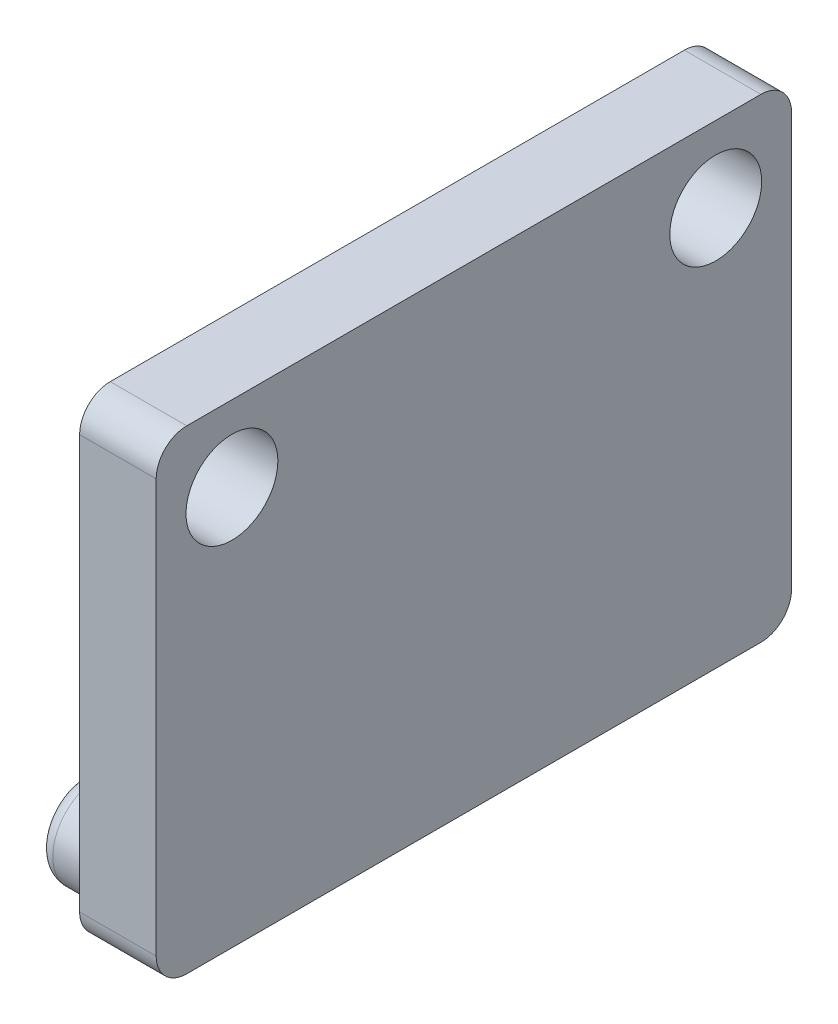
from build123d import *

# Parameters (mm, degrees)
SKETCH1_R                               = 2.25
SKETCH1_R_2                             = 17.5641
BOSS_EXTRUDE1_DEPTH                     = 4.365625
SKETCH2_W                               = 78.1
SKETCH2_H                               = 43.1
BOSS_EXTRUDE2_DEPTH                     = 8.73125
M4_CLEARANCE_HOLE2_AT_2_COUNT           = 2
M4_CLEARANCE_HOLE2_AT_2_PITCH           = 28.1
M4_CLEARANCE_HOLE2_AT_3_COUNT           = 2
M4_CLEARANCE_HOLE2_AT_3_PITCH           = 69.07401827
M4_CLEARANCE_HOLE2_AT_4_COUNT           = 2
M4_CLEARANCE_HOLE2_AT_4_PITCH           = 63.1
SKETCH24_W                              = 78.1
SKETCH24_H                              = 43.1
BOSS_EXTRUDE3_DEPTH                     = 8.73125
TAP_DRILL_FOR_M4X0_7_TAP1_AT_2_COUNT    = 2
TAP_DRILL_FOR_M4X0_7_TAP1_AT_2_PITCH    = 28.1
TAP_DRILL_FOR_M4X0_7_TAP1_AT_3_COUNT    = 2
TAP_DRILL_FOR_M4X0_7_TAP1_AT_3_PITCH    = 69.07401827
TAP_DRILL_FOR_M4X0_7_TAP1_AT_4_COUNT    = 2
TAP_DRILL_FOR_M4X0_7_TAP1_AT_4_PITCH    = 63.1
TAP_DRILL_FOR_M3X0_5_TAP1_AT_2_COUNT    = 2
TAP_DRILL_FOR_M3X0_5_TAP1_AT_2_PITCH    = 36
TAP_DRILL_FOR_M3X0_5_TAP1_AT_3_COUNT    = 2
TAP_DRILL_FOR_M3X0_5_TAP1_AT_3_PITCH    = 28
TAP_DRILL_FOR_M3X0_5_TAP1_AT_4_COUNT    = 2
TAP_DRILL_FOR_M3X0_5_TAP1_AT_4_PITCH    = 45.607017004
TAP_DRILL_FOR_M2_5X0_45_TAP2_AT_2_COUNT = 2
TAP_DRILL_FOR_M2_5X0_45_TAP2_AT_2_PITCH = 15.8
SKETCH3_R                               = 17.5641
CUT_EXTRUDE3_DEPTH                      = 181.027817403
M6_CLEARANCE_HOLE2_AT_2_COUNT           = 2
M6_CLEARANCE_HOLE2_AT_2_PITCH           = 80
SKETCH14_W                              = 86.5
SKETCH14_H                              = 58.5
CUT_EXTRUDE4_DEPTH                      = 2
FILLET4_R                               = 10
M4_CLEARANCE_HOLE1_AT_2_COUNT           = 2
M4_CLEARANCE_HOLE1_AT_2_PITCH           = 14.136551913
M4_CLEARANCE_HOLE1_AT_3_COUNT           = 2
M4_CLEARANCE_HOLE1_AT_3_PITCH           = 7.068275957
M6_CLEARANCE_HOLE1_AT_2_COUNT           = 2
M6_CLEARANCE_HOLE1_AT_2_PITCH           = 25.4
FILLET5_R                               = 5
FILLET6_R                               = 5
SKETCH28_W                              = 15.5
SKETCH28_H                              = 20.75
SKETCH28_R                              = 1.5
BOSS_EXTRUDE4_DEPTH                     = 2.5
FILLET7_R                               = 1
SKETCH29_R                              = 1.5
BOSS_EXTRUDE5_DEPTH                     = 1.5
FILLET8_R                               = 0.5


with BuildPart() as part:
    # Sketch1 → Boss-Extrude1 (new, symmetric)
    with BuildSketch(Plane.YZ):
        Polygon((0, 170.95), (-50, 110.95), (-50, -79.05), (50, -79.05), (50, 110.95), align=None)
        with Locations((-26.25, -56.8)):
            Circle(SKETCH1_R, mode=Mode.SUBTRACT)
        with Locations((-26.25, -32.3)):
            Circle(SKETCH1_R, mode=Mode.SUBTRACT)
        with Locations((26.25, -56.8)):
            Circle(SKETCH1_R, mode=Mode.SUBTRACT)
        with Locations((26.25, -32.3)):
            Circle(SKETCH1_R, mode=Mode.SUBTRACT)
        Circle(SKETCH1_R_2, mode=Mode.SUBTRACT)
    extrude(amount=BOSS_EXTRUDE1_DEPTH, both=True)


with BuildPart() as body_2:
    # Sketch2 → Boss-Extrude2 (new body)
    with BuildSketch(Plane.YZ.offset(4.365625)):
        Rectangle(SKETCH2_W, SKETCH2_H)
    extrude(amount=BOSS_EXTRUDE2_DEPTH)


with BuildPart() as m4_clearance_hole2_tool:
    # Sketch23 → M4 Clearance Hole2 (revolve)
    with BuildSketch(Plane(origin=(13.096875, -31.55, 14.05), x_dir=(0, 0, -1), z_dir=(0, 1, 0))):
        Polygon((0, 0), (0, 17.4625), (2.25, 17.4625), (2.25, 0.025), (2.275, 0), align=None)
    m4_clearance_hole2 = revolve(axis=Axis((19.446875, -31.55, 14.05), (-1, 0, 0)))


with BuildPart() as part_1:
    add(part.part)

    # M4 Clearance Hole2: cut by m4_clearance_hole2_tool
    add(m4_clearance_hole2_tool.part, mode=Mode.SUBTRACT)


with BuildPart() as body_2_1:
    add(body_2.part)

    # M4 Clearance Hole2: cut by m4_clearance_hole2_tool
    add(m4_clearance_hole2_tool.part, mode=Mode.SUBTRACT)


with BuildPart() as m4_clearance_hole2_at_2_tool:
    # M4 Clearance Hole2 at 2: M4 Clearance Hole2 ×2
    with Locations(*[(0, 0, -i * M4_CLEARANCE_HOLE2_AT_2_PITCH) for i in range(1, M4_CLEARANCE_HOLE2_AT_2_COUNT)]):
        add(m4_clearance_hole2)


with BuildPart() as part_2:
    add(part_1.part)

    # M4 Clearance Hole2 at 2: cut by m4_clearance_hole2_at_2_tool
    add(m4_clearance_hole2_at_2_tool.part, mode=Mode.SUBTRACT)


with BuildPart() as body_2_2:
    add(body_2_1.part)

    # M4 Clearance Hole2 at 2: cut by m4_clearance_hole2_at_2_tool
    add(m4_clearance_hole2_at_2_tool.part, mode=Mode.SUBTRACT)


with BuildPart() as m4_clearance_hole2_at_3_tool:
    # M4 Clearance Hole2 at 3: M4 Clearance Hole2 ×2
    with Locations(*[Vector(0, 0.9135128023552276, -0.40680998012966574) * (i * M4_CLEARANCE_HOLE2_AT_3_PITCH) for i in range(1, M4_CLEARANCE_HOLE2_AT_3_COUNT)]):
        add(m4_clearance_hole2)


with BuildPart() as part_3:
    add(part_2.part)

    # M4 Clearance Hole2 at 3: cut by m4_clearance_hole2_at_3_tool
    add(m4_clearance_hole2_at_3_tool.part, mode=Mode.SUBTRACT)


with BuildPart() as body_2_3:
    add(body_2_2.part)

    # M4 Clearance Hole2 at 3: cut by m4_clearance_hole2_at_3_tool
    add(m4_clearance_hole2_at_3_tool.part, mode=Mode.SUBTRACT)


with BuildPart() as m4_clearance_hole2_at_4_tool:
    # M4 Clearance Hole2 at 4: M4 Clearance Hole2 ×2
    with Locations(*[(0, i * M4_CLEARANCE_HOLE2_AT_4_PITCH, 0) for i in range(1, M4_CLEARANCE_HOLE2_AT_4_COUNT)]):
        add(m4_clearance_hole2)


with BuildPart() as part_4:
    add(part_3.part)

    # M4 Clearance Hole2 at 4: cut by m4_clearance_hole2_at_4_tool
    add(m4_clearance_hole2_at_4_tool.part, mode=Mode.SUBTRACT)

    # Sketch7 → Tap Drill for M3x0.5 Tap1 (revolve, cut)
    with BuildSketch(Plane(origin=(4.365625, -18, -24.05), x_dir=(0, 0, -1), z_dir=(0, 1, 0))):
        Polygon((0, 0), (0, 17.4625), (1.25, 17.4625), (1.25, 0.025), (1.275, 0), align=None)
    tap_drill_for_m3x0_5_tap1 = revolve(axis=Axis((10.715625, -18, -24.05), (-1, 0, 0)), mode=Mode.SUBTRACT)

    # Tap Drill for M3x0.5 Tap1 at 2: Tap Drill for M3x0.5 Tap1 ×2
    with Locations(*[(0, i * TAP_DRILL_FOR_M3X0_5_TAP1_AT_2_PITCH, 0) for i in range(1, TAP_DRILL_FOR_M3X0_5_TAP1_AT_2_COUNT)]):
        add(tap_drill_for_m3x0_5_tap1, mode=Mode.SUBTRACT)

    # Tap Drill for M3x0.5 Tap1 at 3: Tap Drill for M3x0.5 Tap1 ×2
    with Locations(*[(0, 0, -i * TAP_DRILL_FOR_M3X0_5_TAP1_AT_3_PITCH) for i in range(1, TAP_DRILL_FOR_M3X0_5_TAP1_AT_3_COUNT)]):
        add(tap_drill_for_m3x0_5_tap1, mode=Mode.SUBTRACT)

    # Tap Drill for M3x0.5 Tap1 at 4: Tap Drill for M3x0.5 Tap1 ×2
    with Locations(*[Vector(0, 0.7893522173763264, -0.6139406135149205) * (i * TAP_DRILL_FOR_M3X0_5_TAP1_AT_4_PITCH) for i in range(1, TAP_DRILL_FOR_M3X0_5_TAP1_AT_4_COUNT)]):
        add(tap_drill_for_m3x0_5_tap1, mode=Mode.SUBTRACT)

    # Sketch10 → Tap Drill for M2.5x0.45 Tap2 (revolve, cut)
    with BuildSketch(Plane(origin=(4.365625, -41, 103.325), x_dir=(0, 0, -1), z_dir=(0, 1, 0))):
        Polygon((0, 0), (0, 17.4625), (1.025, 17.4625), (1.025, 0.025), (1.05, 0), align=None)
    tap_drill_for_m2_5x0_45_tap2 = revolve(axis=Axis((10.715625, -41, 103.325), (-1, 0, 0)), mode=Mode.SUBTRACT)

    # Tap Drill for M2.5x0.45 Tap2 at 2: Tap Drill for M2.5x0.45 Tap2 ×2
    with Locations(*[(0, 0, -i * TAP_DRILL_FOR_M2_5X0_45_TAP2_AT_2_PITCH) for i in range(1, TAP_DRILL_FOR_M2_5X0_45_TAP2_AT_2_COUNT)]):
        add(tap_drill_for_m2_5x0_45_tap2, mode=Mode.SUBTRACT)

    # Sketch12 → M6 Clearance Hole2 (revolve, cut)
    with BuildSketch(Plane(origin=(4.365625, -40, -69.05), x_dir=(0, 0, -1), z_dir=(0, 1, 0))):
        Polygon((0, 0), (0, 17.4625), (3.3, 17.4625), (3.3, 0.025), (3.325, 0), align=None)
    m6_clearance_hole2 = revolve(axis=Axis((10.715625, -40, -69.05), (-1, 0, 0)), mode=Mode.SUBTRACT)

    # M6 Clearance Hole2 at 2: M6 Clearance Hole2 ×2
    with Locations(*[(0, i * M6_CLEARANCE_HOLE2_AT_2_PITCH, 0) for i in range(1, M6_CLEARANCE_HOLE2_AT_2_COUNT)]):
        add(m6_clearance_hole2, mode=Mode.SUBTRACT)

    # Sketch14 → Cut-Extrude4 (cut)
    with BuildSketch(Plane.YZ.offset(4.365625)):
        with Locations((0, 50.8)):
            Rectangle(SKETCH14_W, SKETCH14_H)
    extrude(amount=-CUT_EXTRUDE4_DEPTH, mode=Mode.SUBTRACT)

    # Fillet4
    fillet4_edges = [part_4.edges().sort_by_distance(p)[0] for p in [
        (0, 50, -79.05),
        (0, -50, -79.05),
        (0, 50, 110.95),
        (0, 0, 170.95),
        (0, -50, 110.95),
    ]]
    fillet(fillet4_edges, radius=FILLET4_R)

    # Sketch16 → M4 Clearance Hole1 (revolve, cut)
    with BuildSketch(Plane(origin=(4.365625, 0, 155.329500648), x_dir=(0, 0, -1), z_dir=(0, 1, 0))):
        Polygon((0, 0), (0, 17.4625), (2.25, 17.4625), (2.25, 0.025), (2.275, 0), align=None)
    m4_clearance_hole1 = revolve(axis=Axis((10.715625, 0, 155.329500648), (-1, 0, 0)), mode=Mode.SUBTRACT)

    # M4 Clearance Hole1 at 2: M4 Clearance Hole1 ×2
    with Locations(*[(0, 0, -i * M4_CLEARANCE_HOLE1_AT_2_PITCH) for i in range(1, M4_CLEARANCE_HOLE1_AT_2_COUNT)]):
        add(m4_clearance_hole1, mode=Mode.SUBTRACT)

    # M4 Clearance Hole1 at 3: M4 Clearance Hole1 ×2
    with Locations(*[(0, 0, -i * M4_CLEARANCE_HOLE1_AT_3_PITCH) for i in range(1, M4_CLEARANCE_HOLE1_AT_3_COUNT)]):
        add(m4_clearance_hole1, mode=Mode.SUBTRACT)

    # Sketch21 → M6 Clearance Hole1 (revolve, cut)
    with BuildSketch(Plane(origin=(4.365625, 0, 131.273931646), x_dir=(0, 0, -1), z_dir=(0, 1, 0))):
        Polygon((0, 0), (0, 17.4625), (3.3, 17.4625), (3.3, 0.025), (3.325, 0), align=None)
    m6_clearance_hole1 = revolve(axis=Axis((10.715625, 0, 131.273931646), (-1, 0, 0)), mode=Mode.SUBTRACT)

    # M6 Clearance Hole1 at 2: M6 Clearance Hole1 ×2
    with Locations(*[(0, 0, -i * M6_CLEARANCE_HOLE1_AT_2_PITCH) for i in range(1, M6_CLEARANCE_HOLE1_AT_2_COUNT)]):
        add(m6_clearance_hole1, mode=Mode.SUBTRACT)


with BuildPart() as body_2_4:
    add(body_2_3.part)

    # M4 Clearance Hole2 at 4: cut by m4_clearance_hole2_at_4_tool
    add(m4_clearance_hole2_at_4_tool.part, mode=Mode.SUBTRACT)


with BuildPart() as body_3:
    # Sketch24 → Boss-Extrude3 (new body)
    with BuildSketch(Plane(origin=(-4.365625, 0, 0), x_dir=(0, -1, 0), z_dir=(-1, 0, 0))):
        Rectangle(SKETCH24_W, SKETCH24_H)
    extrude(amount=BOSS_EXTRUDE3_DEPTH)

    # Sketch27 → Tap Drill for M4x0.7 Tap1 (revolve, cut)
    with BuildSketch(Plane(origin=(-13.096875, 31.55, 14.05), x_dir=(0, 0, 1), z_dir=(0, 1, 0))):
        Polygon((0, 0), (0, 9.722670021), (1.65, 8.73125), (1.65, 0.025), (1.675, 0), align=None)
    tap_drill_for_m4x0_7_tap1 = revolve(axis=Axis((-19.446875, 31.55, 14.05), (1, 0, 0)), mode=Mode.SUBTRACT)

    # Tap Drill for M4x0.7 Tap1 at 2: Tap Drill for M4x0.7 Tap1 ×2
    with Locations(*[(0, 0, -i * TAP_DRILL_FOR_M4X0_7_TAP1_AT_2_PITCH) for i in range(1, TAP_DRILL_FOR_M4X0_7_TAP1_AT_2_COUNT)]):
        add(tap_drill_for_m4x0_7_tap1, mode=Mode.SUBTRACT)

    # Tap Drill for M4x0.7 Tap1 at 3: Tap Drill for M4x0.7 Tap1 ×2
    with Locations(*[Vector(0, -0.9135128023552276, -0.40680998012966574) * (i * TAP_DRILL_FOR_M4X0_7_TAP1_AT_3_PITCH) for i in range(1, TAP_DRILL_FOR_M4X0_7_TAP1_AT_3_COUNT)]):
        add(tap_drill_for_m4x0_7_tap1, mode=Mode.SUBTRACT)

    # Tap Drill for M4x0.7 Tap1 at 4: Tap Drill for M4x0.7 Tap1 ×2
    with Locations(*[(0, -i * TAP_DRILL_FOR_M4X0_7_TAP1_AT_4_PITCH, 0) for i in range(1, TAP_DRILL_FOR_M4X0_7_TAP1_AT_4_COUNT)]):
        add(tap_drill_for_m4x0_7_tap1, mode=Mode.SUBTRACT)


with BuildPart() as cut_extrude3_tool:
    # Sketch3 → Cut-Extrude3 (new, through all)
    with BuildSketch(Plane.YZ.offset(13.096875)):
        Circle(SKETCH3_R)
    extrude(amount=-CUT_EXTRUDE3_DEPTH)


with BuildPart() as body_2_5:
    add(body_2_4.part)

    # Cut-Extrude3: cut by cut_extrude3_tool
    add(cut_extrude3_tool.part, mode=Mode.SUBTRACT)

    # Fillet6
    fillet6_edges = [body_2_5.edges().sort_by_distance(p)[0] for p in [
        (8.73125, -39.05, 21.55),
        (8.73125, 39.05, -21.55),
        (8.73125, -39.05, -21.55),
        (8.73125, 39.05, 21.55),
    ]]
    fillet(fillet6_edges, radius=FILLET6_R)


with BuildPart() as body_3_1:
    add(body_3.part)

    # Cut-Extrude3: cut by cut_extrude3_tool
    add(cut_extrude3_tool.part, mode=Mode.SUBTRACT)

    # Fillet5
    fillet5_edges = [body_3_1.edges().sort_by_distance(p)[0] for p in [
        (-8.73125, -39.05, 21.55),
        (-8.73125, -39.05, -21.55),
        (-8.73125, 39.05, -21.55),
        (-8.73125, 39.05, 21.55),
    ]]
    fillet(fillet5_edges, radius=FILLET5_R)


with BuildPart() as body_4:
    # Sketch28 → Boss-Extrude4 (new body)
    with BuildSketch(Plane.YZ.offset(4.365625)):
        with Locations((-46.275, 95.425)):
            Rectangle(SKETCH28_W, SKETCH28_H)
        with Locations((-41, 87.525)):
            Circle(SKETCH28_R, mode=Mode.SUBTRACT)
        with Locations((-41, 103.325)):
            Circle(SKETCH28_R, mode=Mode.SUBTRACT)
    extrude(amount=BOSS_EXTRUDE4_DEPTH)

    # Fillet7
    fillet7_edges = [body_4.edges().sort_by_distance(p)[0] for p in [
        (5.615625, -38.525, 105.8),
        (5.615625, -38.525, 85.05),
        (5.615625, -54.025, 85.05),
        (5.615625, -54.025, 105.8),
    ]]
    fillet(fillet7_edges, radius=FILLET7_R)

    # Sketch29 → Boss-Extrude5 (add)
    with BuildSketch(Plane(origin=(4.365625, 0, 0), x_dir=(0, -1, 0), z_dir=(-1, 0, 0))):
        with Locations((52.025, 104.175)):
            Circle(SKETCH29_R)
        with Locations((52.025, 100.675)):
            Circle(SKETCH29_R)
        with Locations((52.025, 97.175)):
            Circle(SKETCH29_R)
        with Locations((52.025, 93.675)):
            Circle(SKETCH29_R)
        with Locations((52.025, 90.175)):
            Circle(SKETCH29_R)
        with Locations((52.025, 86.675)):
            Circle(SKETCH29_R)
    extrude(amount=BOSS_EXTRUDE5_DEPTH)

    # Fillet8
    fillet8_edges = [body_4.edges().sort_by_distance(p)[0] for p in [
        (2.865625, -50.525, 86.675),
        (2.865625, -50.525, 90.175),
        (2.865625, -50.525, 93.675),
        (2.865625, -50.525, 97.175),
        (2.865625, -50.525, 100.675),
        (2.865625, -50.525, 104.175),
    ]]
    fillet(fillet8_edges, radius=FILLET8_R)


solid = body_4.part
